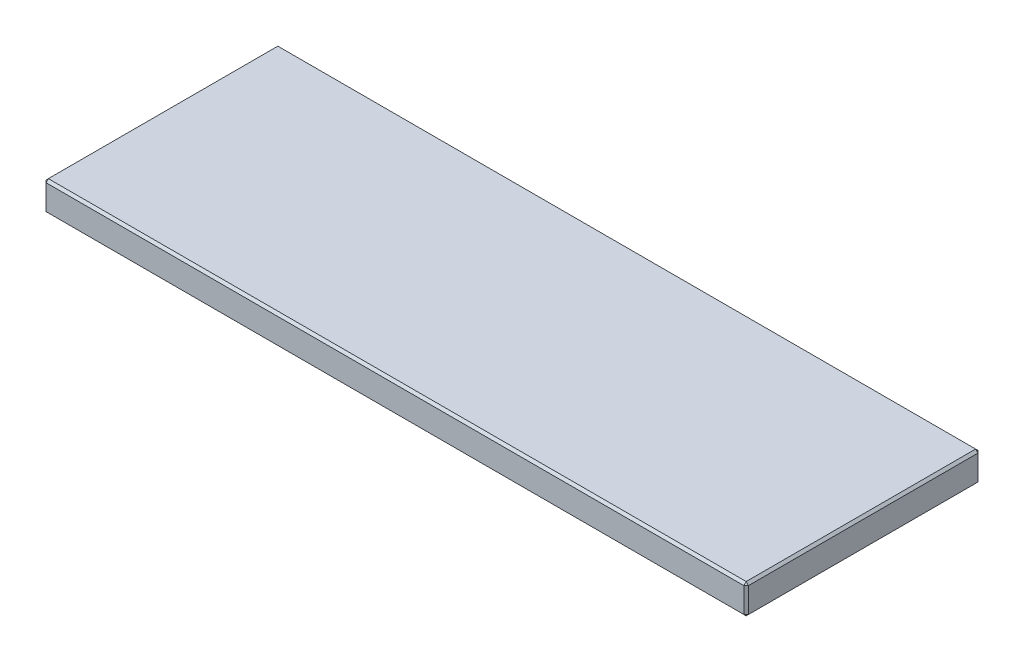
from build123d import *

# Parameters (mm, degrees)
SKETCH1_W           = 75
SKETCH1_H           = 25
BOSS_EXTRUDE1_DEPTH = 3.175
CHAMFER1_SIZE       = 0.25


with BuildPart() as part:
    # Sketch1 → Boss-Extrude1 (new body)
    with BuildSketch(Plane(origin=(0, 0, 0), x_dir=(1, 0, 0), z_dir=(0, 1, 0))):
        Rectangle(SKETCH1_W, SKETCH1_H)
    extrude(amount=BOSS_EXTRUDE1_DEPTH)

    # Chamfer1
    chamfer1_edges = [part.edges().sort_by_distance(p)[0] for p in [
        (-37.5, 3.175, 0),
        (0, 3.175, 12.5),
        (37.5, 3.175, 0),
        (0, 0, 12.5),
        (-37.5, 0, 0),
        (0, 0, -12.5),
        (37.5, 0, 0),
        (37.5, 1.5875, 12.5),
        (-37.5, 1.5875, 12.5),
        (-37.5, 1.5875, -12.5),
        (37.5, 1.5875, -12.5),
        (0, 3.175, -12.5),
    ]]
    chamfer(chamfer1_edges, length=CHAMFER1_SIZE)


solid = part.part
